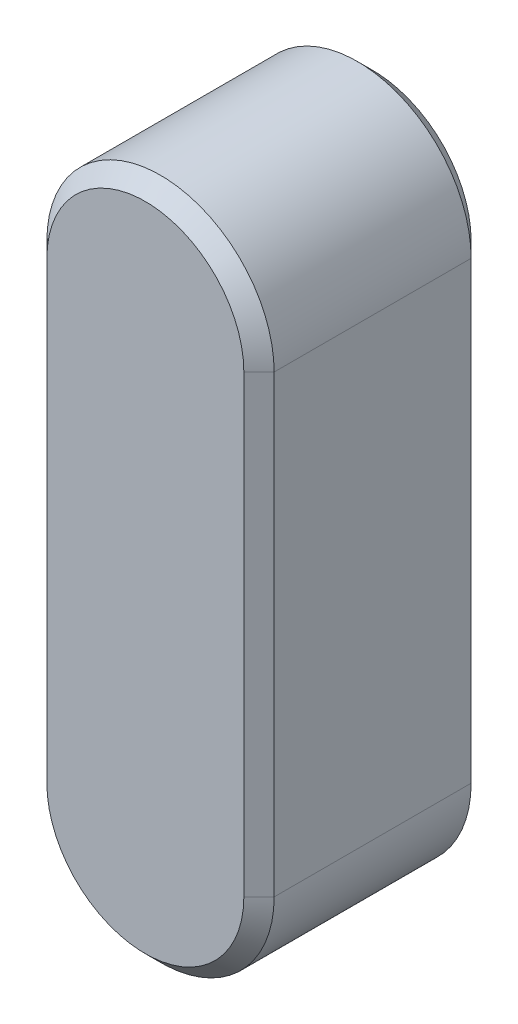
from build123d import *

# Parameters (mm, degrees)
BOSS_EXTRUDE2_DEPTH = 3
CHAMFER3_SIZE       = 0.2


with BuildPart() as part:
    # Sketch2 → Boss-Extrude2 (new body)
    with BuildSketch(Plane.XY):
        with BuildLine():
            Line((-1.5, 0), (-1.5, 6))
            ThreePointArc((-1.5, 6), (0, 7.5), (1.5, 6))
            Line((1.5, 6), (1.5, 0))
            ThreePointArc((1.5, 0), (0, -1.5), (-1.5, 0))
        make_face()
    extrude(amount=BOSS_EXTRUDE2_DEPTH)

    # Chamfer3
    chamfer3_edges = [part.edges().sort_by_distance(p)[0] for p in [
        (0, 7.5, 3),
        (-1.5, 3, 3),
        (0, -1.5, 3),
        (-1.5, 3, 0),
        (0, 7.5, 0),
        (1.5, 3, 0),
        (0, -1.5, 0),
        (1.5, 3, 3),
    ]]
    chamfer(chamfer3_edges, length=CHAMFER3_SIZE)


solid = part.part
